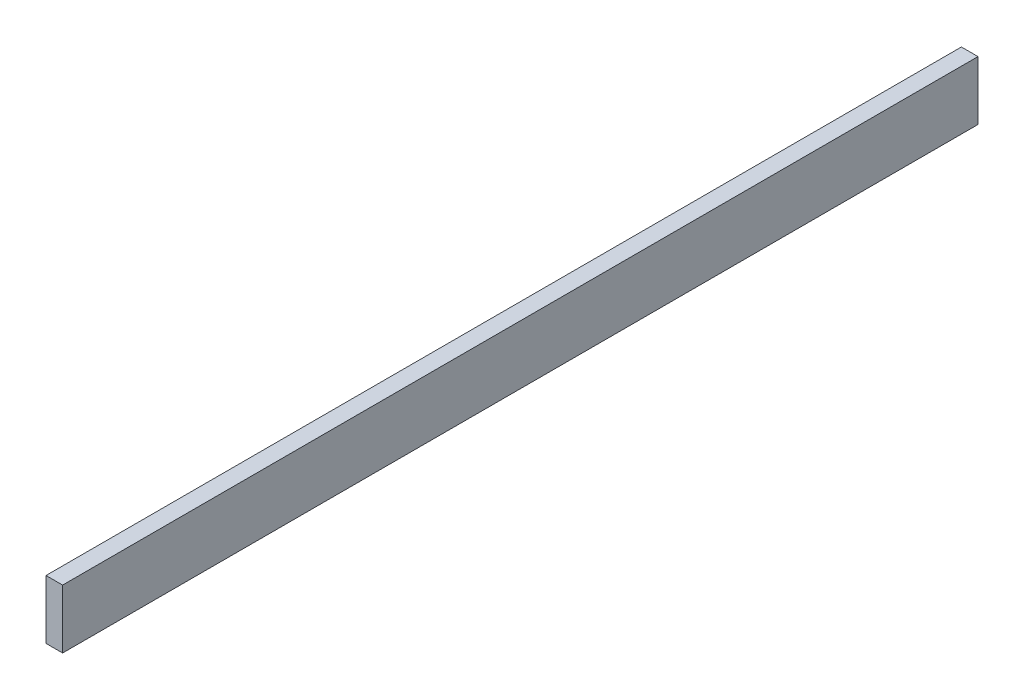
from build123d import *

# Parameters (mm, degrees)
SKETCH1_W                           = 12.7
SKETCH1_H                           = 45
DET_PASIF_RAY_GOVDE_45X12_7_1_DEPTH = 700


with BuildPart() as part:
    # Sketch1 → DET_PASIF_RAY_govde_45x12.7_1 (new body)
    with BuildSketch(Plane.XY):
        with Locations((1331.65, 1549.5)):
            Rectangle(SKETCH1_W, SKETCH1_H)
    extrude(amount=-DET_PASIF_RAY_GOVDE_45X12_7_1_DEPTH)


solid = part.part
